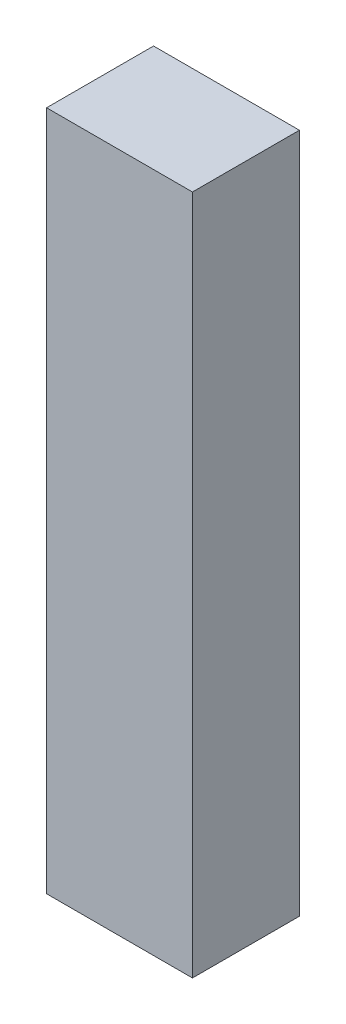
from build123d import *

# Parameters (mm, degrees)
ESQUISSE1_W        = 350
ESQUISSE1_H        = 75
BOSS_EXTRU_1_DEPTH = 55


with BuildPart() as part:
    # Esquisse1 → Boss.-Extru.1 (new body)
    with BuildSketch(Plane(origin=(0, 0, 0), x_dir=(0, 1, 0), z_dir=(0, 0, 1))):
        with Locations((175, 37.5)):
            Rectangle(ESQUISSE1_W, ESQUISSE1_H)
    extrude(amount=BOSS_EXTRU_1_DEPTH)


solid = part.part
